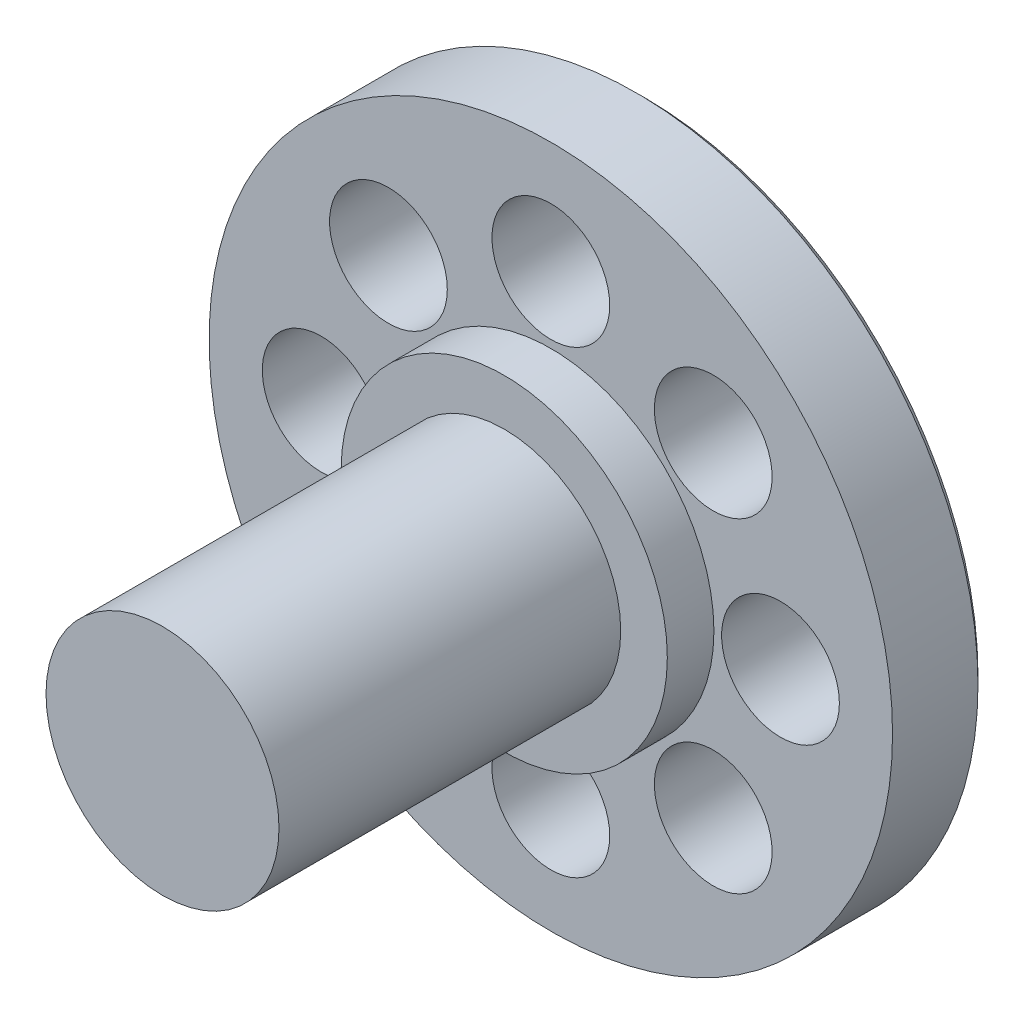
from build123d import *

# Parameters (mm, degrees)
SKETCH1_R           = 22
SKETCH1_R_2         = 3.79
SKETCH1_R_3         = 9
BOSS_EXTRUDE1_DEPTH = 6
SKETCH2_R           = 10.5
BOSS_EXTRUDE2_DEPTH = 25
SKETCH3_R           = 9
SKETCH3_R_2         = 5.75
BOSS_EXTRUDE3_DEPTH = 6
CHAMFER1_SIZE       = 0.5
CUT_EXTRUDE2_START  = -22
SKETCH4_R           = 10.5
SKETCH4_R_2         = 7.5
CUT_EXTRUDE2_DEPTH  = 22
SKETCH5_R           = 5.75
CUT_EXTRUDE3_DEPTH  = 8


with BuildPart() as part:
    # Sketch1 → Boss-Extrude1 (new body)
    with BuildSketch(Plane.XY):
        Circle(SKETCH1_R)
        with Locations((0, 14.785)):
            Circle(SKETCH1_R_2, mode=Mode.SUBTRACT)
        with Locations((10.45457376, 10.45457376)):
            Circle(SKETCH1_R_2, mode=Mode.SUBTRACT)
        with Locations((14.785, 0)):
            Circle(SKETCH1_R_2, mode=Mode.SUBTRACT)
        with Locations((10.45457376, -10.45457376)):
            Circle(SKETCH1_R_2, mode=Mode.SUBTRACT)
        with Locations((0, -14.785)):
            Circle(SKETCH1_R_2, mode=Mode.SUBTRACT)
        with Locations((-10.45457376, -10.45457376)):
            Circle(SKETCH1_R_2, mode=Mode.SUBTRACT)
        with Locations((-14.785, 0)):
            Circle(SKETCH1_R_2, mode=Mode.SUBTRACT)
        with Locations((-10.45457376, 10.45457376)):
            Circle(SKETCH1_R_2, mode=Mode.SUBTRACT)
        Circle(SKETCH1_R_3, mode=Mode.SUBTRACT)
    extrude(amount=BOSS_EXTRUDE1_DEPTH)

    # Sketch2 → Boss-Extrude2 (add)
    with BuildSketch(Plane.XY.offset(6)):
        Circle(SKETCH2_R)
    extrude(amount=BOSS_EXTRUDE2_DEPTH)

    # Sketch3 → Boss-Extrude3 (add)
    with BuildSketch(Plane(origin=(0, 0, 0), x_dir=(-1, 0, 0), z_dir=(0, 0, -1))):
        Circle(SKETCH3_R)
        Circle(SKETCH3_R_2, mode=Mode.SUBTRACT)
    extrude(amount=-BOSS_EXTRUDE3_DEPTH)

    # Chamfer1
    chamfer1_edges = [part.edges().sort_by_distance(p)[0] for p in [
        (6.66457376, 10.45457376, 0),
        (10.995, 0, 0),
        (-22, 0, 0),
        (6.66457376, -10.45457376, 0),
        (-3.79, -14.785, 0),
        (-14.24457376, -10.45457376, 0),
        (-18.575, 0, 0),
        (-14.24457376, 10.45457376, 0),
        (5.75, 0, 0),
        (-3.79, 14.785, 0),
    ]]
    chamfer(chamfer1_edges, length=CHAMFER1_SIZE)

    # Sketch4 → Cut-Extrude2 (cut)
    with BuildSketch(Plane.XY.offset(31).offset(CUT_EXTRUDE2_START)):
        Circle(SKETCH4_R)
        Circle(SKETCH4_R_2, mode=Mode.SUBTRACT)
    extrude(amount=CUT_EXTRUDE2_DEPTH, mode=Mode.SUBTRACT)

    # Sketch5 → Cut-Extrude3 (cut)
    with BuildSketch(Plane(origin=(0, 0, 0), x_dir=(-1, 0, 0), z_dir=(0, 0, -1))):
        Circle(SKETCH5_R)
    extrude(amount=-CUT_EXTRUDE3_DEPTH, mode=Mode.SUBTRACT)


solid = part.part
